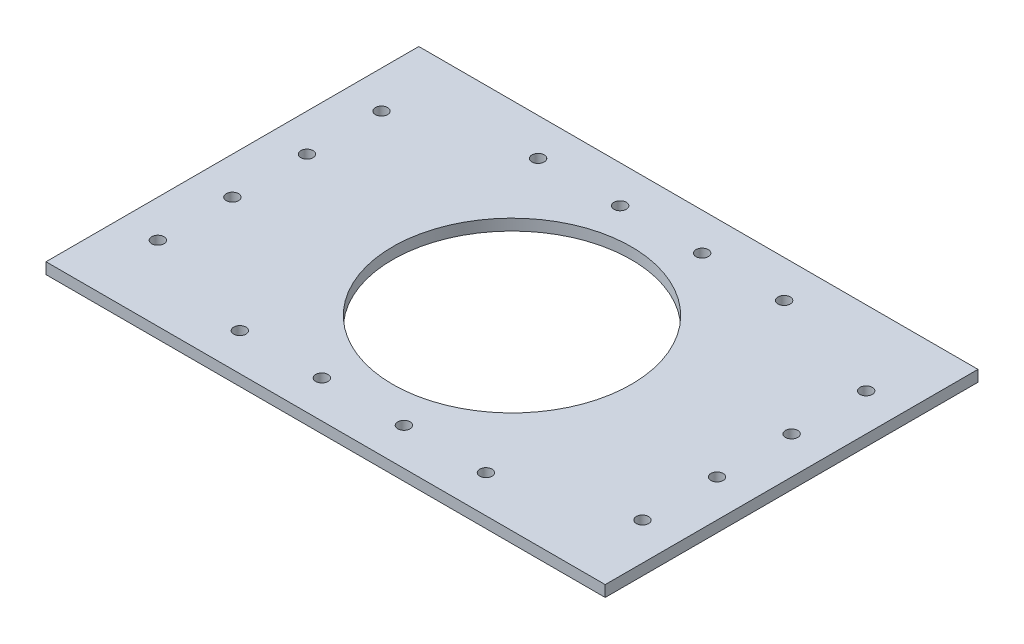
from build123d import *

# Parameters (mm, degrees)
SKETCH_1_W      = 150
SKETCH_1_H      = 100
SKETCH_1_R      = 32
SKETCH_1_R_2    = 1.65
EXTRUDE_1_DEPTH = 3


with BuildPart() as part:
    # 草图1 → 凸台-拉伸1 (new body)
    with BuildSketch(Plane(origin=(0, 0, 0), x_dir=(1, 0, 0), z_dir=(0, 1, 0))):
        Rectangle(SKETCH_1_W, SKETCH_1_H)
        with Locations(Location((0, 0, 0), (0, 0, 270))):
            Circle(SKETCH_1_R, mode=Mode.SUBTRACT)
        with Locations(Location((-65, 30, 0), (0, 0, 270))):
            Circle(SKETCH_1_R_2, mode=Mode.SUBTRACT)
        with Locations(Location((-65, 10, 0), (0, 0, 270))):
            Circle(SKETCH_1_R_2, mode=Mode.SUBTRACT)
        with Locations(Location((-65, -10, 0), (0, 0, 270))):
            Circle(SKETCH_1_R_2, mode=Mode.SUBTRACT)
        with Locations(Location((-65, -30, 0), (0, 0, 270))):
            Circle(SKETCH_1_R_2, mode=Mode.SUBTRACT)
        with Locations(Location((65, -30, 0), (0, 0, 90))):
            Circle(SKETCH_1_R_2, mode=Mode.SUBTRACT)
        with Locations(Location((65, -10, 0), (0, 0, 90))):
            Circle(SKETCH_1_R_2, mode=Mode.SUBTRACT)
        with Locations(Location((65, 10, 0), (0, 0, 90))):
            Circle(SKETCH_1_R_2, mode=Mode.SUBTRACT)
        with Locations(Location((65, 30, 0), (0, 0, 90))):
            Circle(SKETCH_1_R_2, mode=Mode.SUBTRACT)
        with Locations(Location((33, 40, 0), (0, 0, 270))):
            Circle(SKETCH_1_R_2, mode=Mode.SUBTRACT)
        with Locations(Location((11, 40, 0), (0, 0, 270))):
            Circle(SKETCH_1_R_2, mode=Mode.SUBTRACT)
        with Locations(Location((-11, 40, 0), (0, 0, 270))):
            Circle(SKETCH_1_R_2, mode=Mode.SUBTRACT)
        with Locations(Location((-33, 40, 0), (0, 0, 270))):
            Circle(SKETCH_1_R_2, mode=Mode.SUBTRACT)
        with Locations(Location((33, -40, 0), (0, 0, 90))):
            Circle(SKETCH_1_R_2, mode=Mode.SUBTRACT)
        with Locations(Location((11, -40, 0), (0, 0, 90))):
            Circle(SKETCH_1_R_2, mode=Mode.SUBTRACT)
        with Locations(Location((-11, -40, 0), (0, 0, 90))):
            Circle(SKETCH_1_R_2, mode=Mode.SUBTRACT)
        with Locations(Location((-33, -40, 0), (0, 0, 90))):
            Circle(SKETCH_1_R_2, mode=Mode.SUBTRACT)
    extrude(amount=EXTRUDE_1_DEPTH)


solid = part.part
